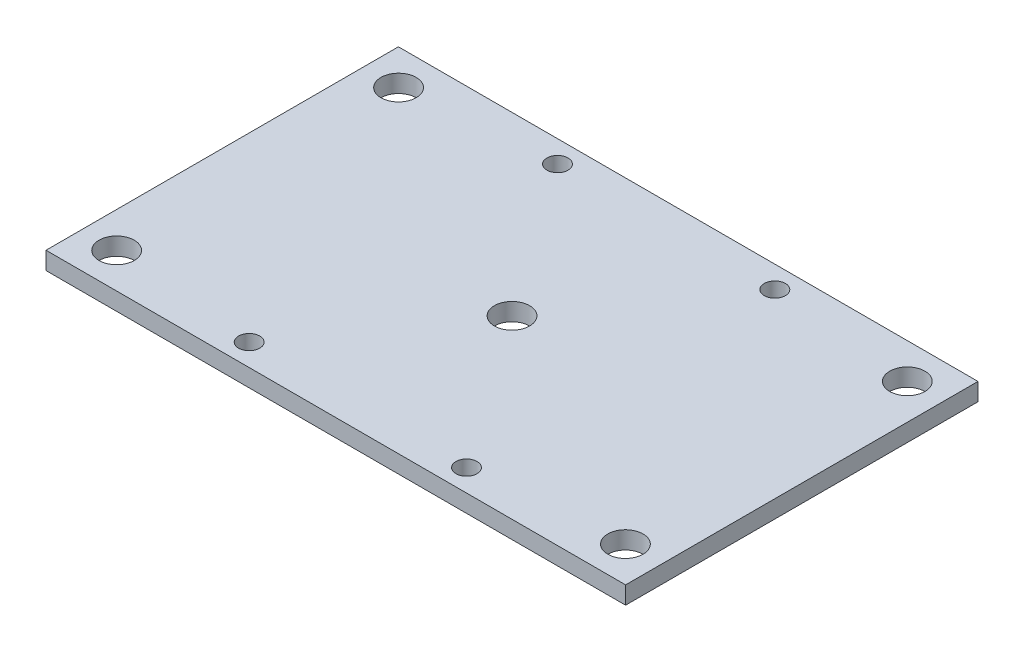
from build123d import *

# Parameters (mm, degrees)
ESQUISSE1_W             = 180.475
ESQUISSE1_H             = 100
ESQUISSE1_R             = 5
BOSS_EXTRU_1_DEPTH      = 5
ESQUISSE2_W             = 8
ESQUISSE2_H             = 100
ENL_V_MAT_EXTRU_1_DEPTH = 5
ESQUISSE3_R             = 3
ENL_V_MAT_EXTRU_2_DEPTH = 5


with BuildPart() as part:
    # Esquisse1 → Boss.-Extru.1 (new body)
    with BuildSketch(Plane(origin=(0, 0, 0), x_dir=(1, 0, 0), z_dir=(0, 1, 0))):
        Rectangle(ESQUISSE1_W, ESQUISSE1_H)
        with Locations(Location((-72.19, 40, 0), (0, 0, 270))):
            Circle(ESQUISSE1_R, mode=Mode.SUBTRACT)
        with Locations(Location((72.19, 40, 0), (0, 0, 90))):
            Circle(ESQUISSE1_R, mode=Mode.SUBTRACT)
        with Locations(Location((72.19, -40, 0), (0, 0, 270))):
            Circle(ESQUISSE1_R, mode=Mode.SUBTRACT)
        with Locations(Location((-72.19, -40, 0), (0, 0, 90))):
            Circle(ESQUISSE1_R, mode=Mode.SUBTRACT)
        with Locations(Location((0, 0, 0), (0, 0, 270))):
            Circle(ESQUISSE1_R, mode=Mode.SUBTRACT)
    extrude(amount=BOSS_EXTRU_1_DEPTH)

    # Esquisse2 → Enlèv. mat.-Extru.1 (cut)
    with BuildSketch(Plane(origin=(0, 5, 0), x_dir=(1, 0, 0), z_dir=(0, 1, 0))):
        with Locations((-86.2375, 0)):
            Rectangle(ESQUISSE2_W, ESQUISSE2_H)
        with Locations((86.2375, 0)):
            Rectangle(ESQUISSE2_W, ESQUISSE2_H)
    extrude(amount=-ENL_V_MAT_EXTRU_1_DEPTH, mode=Mode.SUBTRACT)

    # Esquisse3 → Enlèv. mat.-Extru.2 (cut)
    with BuildSketch(Plane(origin=(0, 5, 0), x_dir=(1, 0, 0), z_dir=(0, 1, 0))):
        with Locations(Location((-30.8390625, 43.75, 0), (0, 0, 270))):
            Circle(ESQUISSE3_R)
        with Locations(Location((30.8390625, 43.75, 0), (0, 0, 270))):
            Circle(ESQUISSE3_R)
        with Locations(Location((30.8390625, -43.75, 0), (0, 0, 270))):
            Circle(ESQUISSE3_R)
        with Locations(Location((-30.8390625, -43.75, 0), (0, 0, 270))):
            Circle(ESQUISSE3_R)
    extrude(amount=-ENL_V_MAT_EXTRU_2_DEPTH, mode=Mode.SUBTRACT)


solid = part.part
